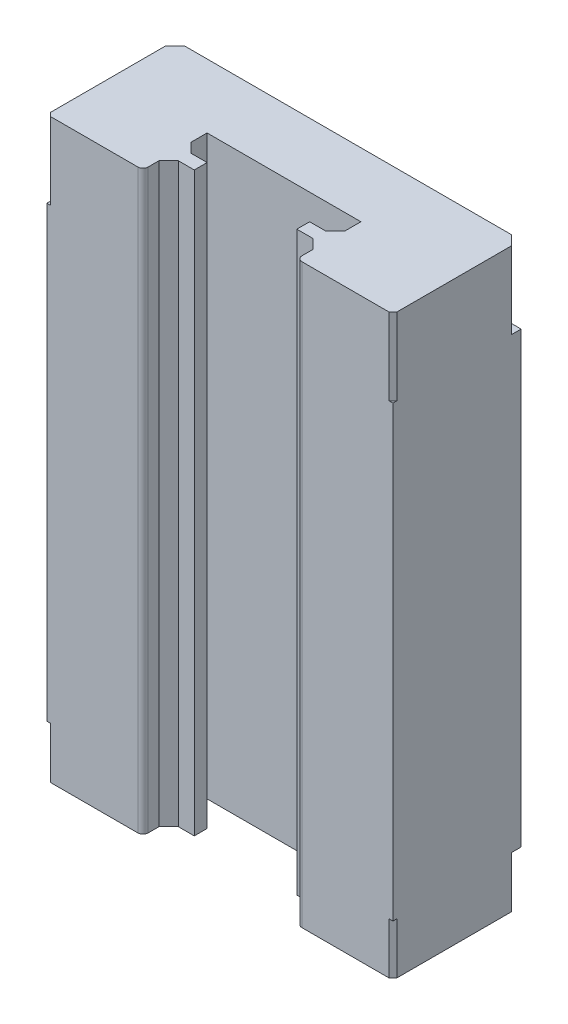
from build123d import *

# Parameters (mm, degrees)
BOSS_EXTRUDE1_DEPTH = 45
FILLET1_R           = 0.4
SKETCH3_R           = 1.5
CUT_EXTRUDE3_DEPTH  = 5
CUT_EXTRUDE5_DEPTH  = 6


with BuildPart() as part:
    # Sketch2 → Boss-Extrude1 (new body)
    with BuildSketch(Plane(origin=(0, 0, 0), x_dir=(1, 0, 0), z_dir=(0, 1, 0))):
        Polygon((-13.5, 5), (13.5, 5), (13.5, -5), (6, -5), (6, -3.75), (5.25, -3), (4, -3), (4, -2), (5.25, -2), (6, -1.25), (6, 0), (-6, 0), (-6, -1.25), (-5.25, -2), (-4, -2), (-4, -3), (-5.25, -3), (-6, -3.75), (-6, -5), (-13.5, -5), align=None)
    extrude(amount=BOSS_EXTRUDE1_DEPTH)

    # Fillet1
    fillet1_edges = [part.edges().sort_by_distance(p)[0] for p in [
        (6, 22.5, 5),
        (-6, 22.5, 5),
    ]]
    fillet(fillet1_edges, radius=FILLET1_R)

    # Sketch3 → Cut-Extrude3 (cut)
    with BuildSketch(Plane(origin=(0, 0, -5), x_dir=(-1, 0, 0), z_dir=(0, 0, -1))):
        with Locations((10, 33.5)):
            Circle(SKETCH3_R)
        with Locations((-10, 33.5)):
            Circle(SKETCH3_R)
        with Locations((-10, 13.5)):
            Circle(SKETCH3_R)
        with Locations((10, 13.5)):
            Circle(SKETCH3_R)
    extrude(amount=-CUT_EXTRUDE3_DEPTH, mode=Mode.SUBTRACT)

    # Sketch4 → Cut-Extrude5 (cut)
    with BuildSketch(Plane(origin=(0, 45, 0), x_dir=(1, 0, 0), z_dir=(0, 1, 0))):
        Polygon((-13.5, 5), (-13.5, 4.25), (-12.75, 5), align=None)
        Polygon((13.5, 4.25), (12.75, 5), (13.5, 5), align=None)
        Polygon((-13.5, -5), (-13.2, -5), (-13.5, -4.7), align=None)
        Polygon((13.2, -5), (13.5, -4.7), (13.5, -5), align=None)
    cut_extrude5 = extrude(amount=-CUT_EXTRUDE5_DEPTH, mode=Mode.SUBTRACT)

    # Mirror1: Cut-Extrude5 across plane
    add(cut_extrude5.mirror(Plane.ZX.offset(21.5)), mode=Mode.SUBTRACT)


solid = part.part
